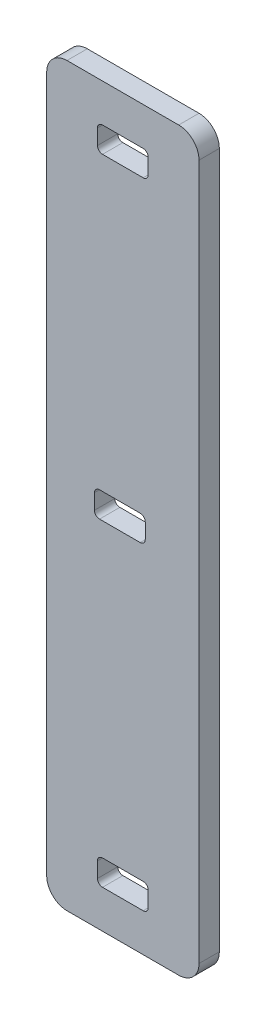
from build123d import *

# Parameters (mm, degrees)
BOSS_EXTRU_1_DEPTH      = 4
ENL_V_MAT_EXTRU_1_DEPTH = 75.143442057


with BuildPart() as part:
    # Esquisse1 → Boss.-Extru.1 (new body)
    with BuildSketch(Plane.XY):
        with BuildLine():
            Line((-11, -72.5), (11, -72.5))
            ThreePointArc((11, -72.5), (13.828427125, -71.328427125), (15, -68.5))
            Line((15, -68.5), (15, 68.5))
            ThreePointArc((15, 68.5), (13.828427125, 71.328427125), (11, 72.5))
            Line((11, 72.5), (-11, 72.5))
            ThreePointArc((-11, 72.5), (-13.828427125, 71.328427125), (-15, 68.5))
            Line((-15, 68.5), (-15, -68.5))
            ThreePointArc((-15, -68.5), (-13.828427125, -71.328427125), (-11, -72.5))
        make_face()
    extrude(amount=BOSS_EXTRU_1_DEPTH)

    # Esquisse2 → Enlèv. mat.-Extru.1 (cut, through all)
    with BuildSketch(Plane.XY.offset(4)):
        with BuildLine():
            Line((-4, -60), (4, -60))
            ThreePointArc((4, -60), (4.707106781, -60.292893219), (5, -61))
            Line((5, -61), (5, -64))
            ThreePointArc((5, -64), (4.707106781, -64.707106781), (4, -65))
            Line((4, -65), (-4, -65))
            ThreePointArc((-4, -65), (-4.707106781, -64.707106781), (-5, -64))
            Line((-5, -64), (-5, -61))
            ThreePointArc((-5, -61), (-4.707106781, -60.292893219), (-4, -60))
        make_face()
        with BuildLine():
            Line((-4, 65), (4, 65))
            ThreePointArc((4, 65), (4.707106781, 64.707106781), (5, 64))
            Line((5, 64), (5, 61))
            ThreePointArc((5, 61), (4.707106781, 60.292893219), (4, 60))
            Line((4, 60), (-4, 60))
            ThreePointArc((-4, 60), (-4.707106781, 60.292893219), (-5, 61))
            Line((-5, 61), (-5, 64))
            ThreePointArc((-5, 64), (-4.707106781, 64.707106781), (-4, 65))
        make_face()
        with BuildLine():
            Line((-4.587622439, 2.5), (3.412377561, 2.5))
            ThreePointArc((3.412377561, 2.5), (4.119484342, 2.207106781), (4.412377561, 1.5))
            Line((4.412377561, 1.5), (4.412377561, -1.5))
            ThreePointArc((4.412377561, -1.5), (4.119484342, -2.207106781), (3.412377561, -2.5))
            Line((3.412377561, -2.5), (-4.587622439, -2.5))
            ThreePointArc((-4.587622439, -2.5), (-5.29472922, -2.207106781), (-5.587622439, -1.5))
            Line((-5.587622439, -1.5), (-5.587622439, 1.5))
            ThreePointArc((-5.587622439, 1.5), (-5.29472922, 2.207106781), (-4.587622439, 2.5))
        make_face()
    extrude(amount=-ENL_V_MAT_EXTRU_1_DEPTH, mode=Mode.SUBTRACT)


solid = part.part
